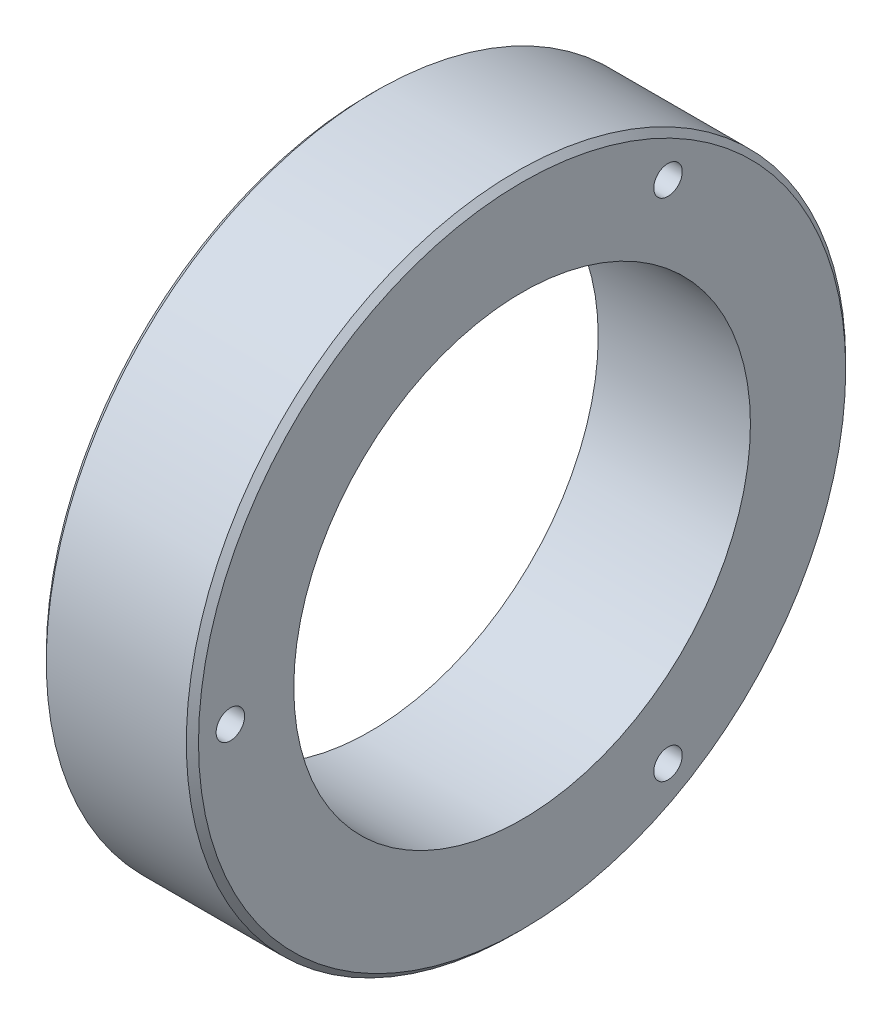
from build123d import *

# Parameters (mm, degrees)
SKETCH1_R           = 82.5246
BOSS_EXTRUDE1_DEPTH = 38.1
SKETCH2_R           = 57.15
CUT_EXTRUDE1_DEPTH  = 38.1
SKETCH3_R           = 3.5687
CUT_EXTRUDE3_DEPTH  = 123.769007532
SKETCH4_R           = 5.5626
CUT_EXTRUDE4_DEPTH  = 9.652
CHAMFER1_SIZE       = 1.524


with BuildPart() as part:
    # Sketch1 → Boss-Extrude1 (new body)
    with BuildSketch(Plane.YZ):
        with Locations(Location((0, 0, 0), (0, 0, 270))):
            Circle(SKETCH1_R)
    extrude(amount=BOSS_EXTRUDE1_DEPTH)

    # Sketch2 → Cut-Extrude1 (cut)
    with BuildSketch(Plane.YZ):
        with Locations(Location((0, 0, 0), (0, 0, 270))):
            Circle(SKETCH2_R)
    extrude(amount=CUT_EXTRUDE1_DEPTH, mode=Mode.SUBTRACT)

    # Sketch3 → Cut-Extrude3 (cut, through all)
    with BuildSketch(Plane.YZ):
        with Locations(Location((0, 73.025, 0), (0, 0, 270))):
            Circle(SKETCH3_R)
        with Locations(Location((-63.241505111, -36.5125, 0), (0, 0, 270))):
            Circle(SKETCH3_R)
        with Locations(Location((63.241505111, -36.5125, 0), (0, 0, 270))):
            Circle(SKETCH3_R)
    extrude(amount=CUT_EXTRUDE3_DEPTH, mode=Mode.SUBTRACT)

    # Sketch4 → Cut-Extrude4 (cut)
    with BuildSketch(Plane.YZ):
        with Locations(Location((0, 73.025, 0), (0, 0, 270))):
            Circle(SKETCH4_R)
        with Locations(Location((-63.241505111, -36.5125, 0), (0, 0, 270))):
            Circle(SKETCH4_R)
        with Locations(Location((63.241505111, -36.5125, 0), (0, 0, 270))):
            Circle(SKETCH4_R)
    extrude(amount=CUT_EXTRUDE4_DEPTH, mode=Mode.SUBTRACT)

    # Chamfer1
    chamfer1_edges = [part.edges().sort_by_distance(p)[0] for p in [
        (0, 0, 82.5246),
        (38.1, 0, 82.5246),
    ]]
    chamfer(chamfer1_edges, length=CHAMFER1_SIZE)


solid = part.part
